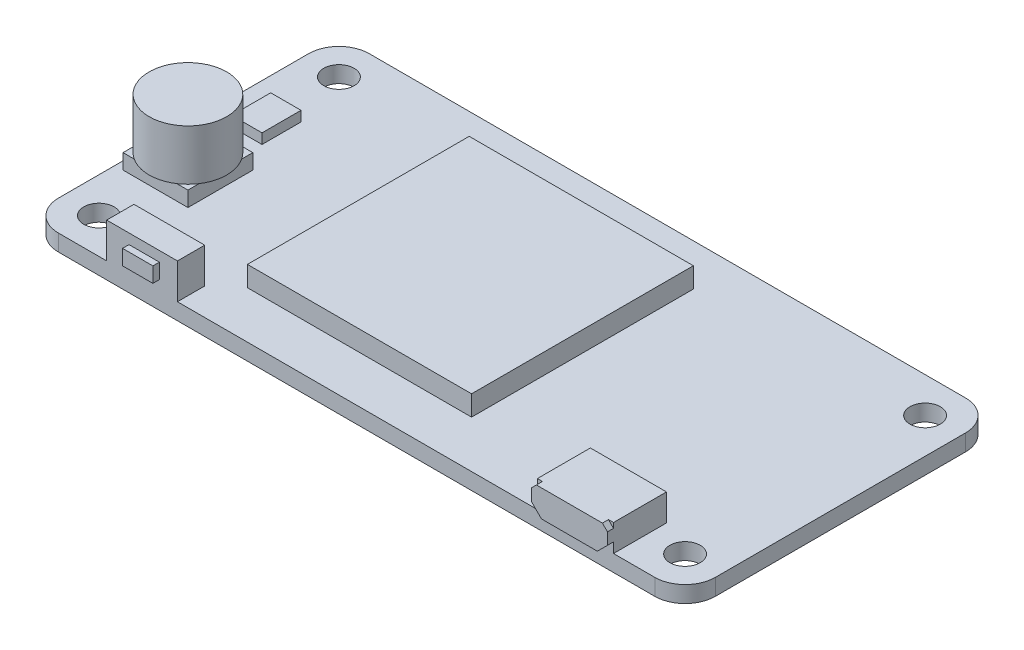
from build123d import *

# Parameters (mm, degrees)
EXTRUDE_1_DEPTH     = 1.63
SKETCH_2_R          = 1.5
CUT_EXTRUDE_1_DEPTH = 36.99024208
SKETCH_8_W          = 51
SKETCH_8_H          = 5
EXTRUDE_6_DEPTH     = 3.68
SKETCH_9_W          = 7
SKETCH_9_H          = 2.7
EXTRUDE_7_DEPTH     = 3.5
SKETCH_10_W         = 7.53
SKETCH_10_H         = 5.24
EXTRUDE_8_DEPTH     = 2.66
SKETCH_11_W         = 22.18
SKETCH_11_H         = 21.945686578
EXTRUDE_9_DEPTH     = 2
SKETCH_12_W         = 6.42
SKETCH_12_H         = 6.42
EXTRUDE_10_DEPTH    = 1.5
SKETCH_13_W         = 3
SKETCH_13_H         = 3.86
EXTRUDE_11_DEPTH    = 1
SKETCH_14_R         = 3.84
EXTRUDE_12_DEPTH    = 5
SKETCH_15_W         = 3
SKETCH_15_H         = 1.5
EXTRUDE_13_DEPTH    = 0.64
EXTRUDE_14_DEPTH    = 0.6


with BuildPart() as part:
    # 草图1 → 凸台-拉伸1 (new body)
    with BuildSketch(Plane(origin=(0, 0, 0), x_dir=(1, 0, 0), z_dir=(0, 1, 0))):
        with BuildLine():
            Line((-29.5, 15.375), (29.5, 15.375))
            ThreePointArc((29.5, 15.375), (31.621320344, 14.496320344), (32.5, 12.375))
            Line((32.5, 12.375), (32.5, -12.375))
            ThreePointArc((32.5, -12.375), (31.621320344, -14.496320344), (29.5, -15.375))
            Line((29.5, -15.375), (-29.5, -15.375))
            ThreePointArc((-29.5, -15.375), (-31.621320344, -14.496320344), (-32.5, -12.375))
            Line((-32.5, -12.375), (-32.5, 12.375))
            ThreePointArc((-32.5, 12.375), (-31.621320344, 14.496320344), (-29.5, 15.375))
        make_face()
    extrude(amount=EXTRUDE_1_DEPTH)

    # 草图2 → 切除-拉伸1 (cut, through all)
    with BuildSketch(Plane(origin=(0, 1.63, 0), x_dir=(1, 0, 0), z_dir=(0, 1, 0))):
        with Locations(Location((-29, 11.875, 0), (0, 0, 270))):
            Circle(SKETCH_2_R)
        with Locations(Location((-29, -11.875, 0), (0, 0, 270))):
            Circle(SKETCH_2_R)
        with Locations(Location((29, -11.875, 0), (0, 0, 270))):
            Circle(SKETCH_2_R)
        with Locations(Location((29, 11.875, 0), (0, 0, 270))):
            Circle(SKETCH_2_R)
    extrude(amount=-CUT_EXTRUDE_1_DEPTH, mode=Mode.SUBTRACT)

    # 草图8 → 凸台-拉伸6 (add)
    with BuildSketch(Plane.XZ):
        with Locations((-0.2, -11.235)):
            Rectangle(SKETCH_8_W, SKETCH_8_H)
    extrude(amount=EXTRUDE_6_DEPTH)

    # 草图9 → 凸台-拉伸7 (add)
    with BuildSketch(Plane(origin=(0, 1.63, 0), x_dir=(1, 0, 0), z_dir=(0, 1, 0))):
        with Locations((-21.23, -14.025)):
            Rectangle(SKETCH_9_W, SKETCH_9_H)
    extrude(amount=EXTRUDE_7_DEPTH)

    # 草图10 → 凸台-拉伸8 (add)
    with BuildSketch(Plane(origin=(0, 1.63, 0), x_dir=(1, 0, 0), z_dir=(0, 1, 0))):
        with Locations((21.655, -12.755)):
            Rectangle(SKETCH_10_W, SKETCH_10_H)
    extrude(amount=EXTRUDE_8_DEPTH)

    # 草图11 → 凸台-拉伸9 (add)
    with BuildSketch(Plane(origin=(0, 1.63, 0), x_dir=(1, 0, 0), z_dir=(0, 1, 0))):
        with Locations((-4.38, 0.262156711)):
            Rectangle(SKETCH_11_W, SKETCH_11_H)
    extrude(amount=EXTRUDE_9_DEPTH)

    # 草图12 → 凸台-拉伸10 (add)
    with BuildSketch(Plane(origin=(0, 1.63, 0), x_dir=(1, 0, 0), z_dir=(0, 1, 0))):
        with Locations((-28.49, -3.575)):
            Rectangle(SKETCH_12_W, SKETCH_12_H)
    extrude(amount=EXTRUDE_10_DEPTH)

    # 草图13 → 凸台-拉伸11 (add)
    with BuildSketch(Plane(origin=(0, 1.63, 0), x_dir=(1, 0, 0), z_dir=(0, 1, 0))):
        with Locations((-28.52, 4.215)):
            Rectangle(SKETCH_13_W, SKETCH_13_H)
    extrude(amount=EXTRUDE_11_DEPTH)

    # 草图14 → 凸台-拉伸12 (add)
    with BuildSketch(Plane(origin=(0, 3.13, 0), x_dir=(1, 0, 0), z_dir=(0, 1, 0))):
        with Locations(Location((-28.49, -3.575, 0), (0, 0, 56.713583662))):
            Circle(SKETCH_14_R)
    extrude(amount=EXTRUDE_12_DEPTH)

    # 草图15 → 凸台-拉伸13 (add)
    with BuildSketch(Plane.XY.offset(15.375)):
        with Locations((-21.02, 3.38)):
            Rectangle(SKETCH_15_W, SKETCH_15_H)
    extrude(amount=EXTRUDE_13_DEPTH)

    # 草图16 → 凸台-拉伸14 (add)
    with BuildSketch(Plane.XY.offset(15.375)):
        Polygon((17.89, 3.79), (18.39, 4.29), (24.92, 4.29), (25.42, 3.79), (25.42, 2.63), (24.42, 1.63), (18.89, 1.63), (17.89, 2.63), align=None)
    extrude(amount=EXTRUDE_14_DEPTH)


solid = part.part
